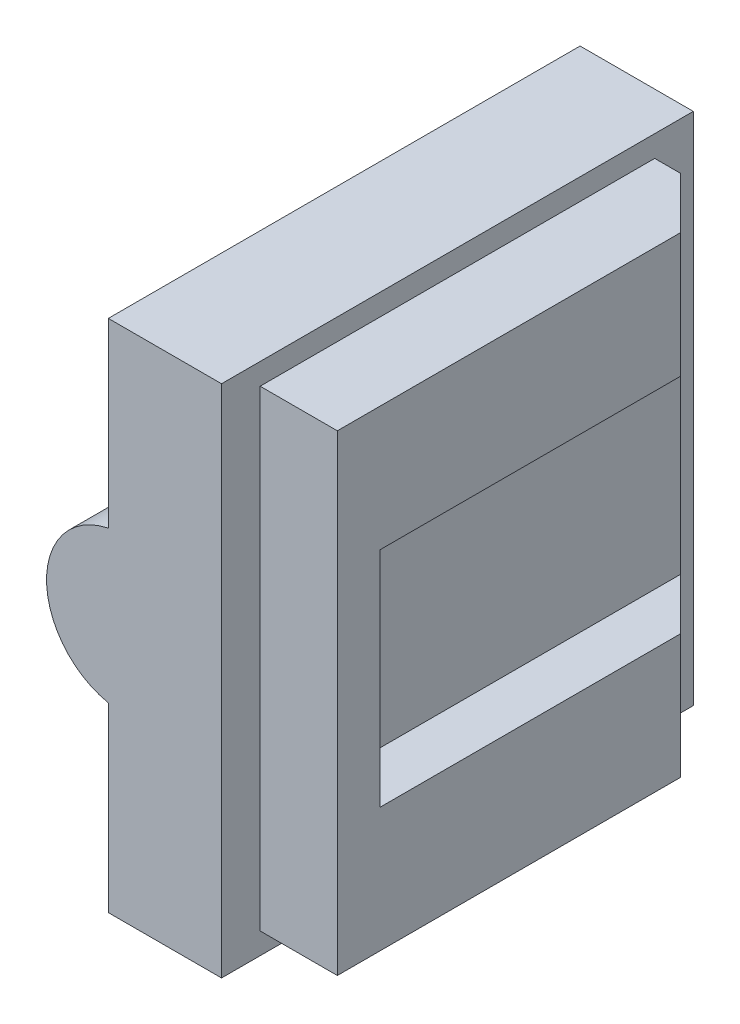
from build123d import *

# Parameters (mm, degrees)
SKETCH_1_R                 = 2.9
EXTRUDE_1_DEPTH            = 30
SKETCH_2_W                 = 27.5
SKETCH_2_H                 = 30
EXTRUDE_2_DEPTH            = 17
CUT_EXTRUDE_1_REACH        = 39.833
SKETCH_3_W                 = 27.5
SKETCH_3_H                 = 19.8
SKETCH_4_W                 = 27.5
SKETCH_4_H                 = 30
SKETCH_4_W_2               = 23
SKETCH_4_H_2               = 27.5
CUT_EXTRUDE_2_DEPTH        = 4.5
CHAMFER_1_SIZE             = 3
SKETCH_5_W                 = 20.5
SKETCH_5_H                 = 13
CUT_EXTRUDE_3_DEPTH        = 3
SKETCH_6_R                 = 7.5
SKETCH_6_R_2               = 2.9
EXTRUDE_3_DEPTH            = 2.2
CHAMFER_2_SIZE             = 2
CHAMFER_2_OF_MIRROR_1_SIZE = 2
CUT_EXTRUDE_4_REACH        = 52.113
SKETCH_7_W                 = 25
SKETCH_7_H                 = 34.4
SKETCH_8_W                 = 25.25
SKETCH_8_H                 = 27.75
SKETCH_8_W_2               = 24.85
SKETCH_8_H_2               = 27.35
EXTRUDE_4_DEPTH            = 0.5
SKETCH_9_W                 = 24.85
SKETCH_9_H                 = 27.35
CUT_EXTRUDE_5_DEPTH        = 5
SKETCH_10_R                = 4.5
EXTRUDE_5_DEPTH            = 5
SKETCH_11_R                = 2.85
SKETCH_11_R_2              = 0.85
EXTRUDE_6_DEPTH            = 5


with BuildPart() as part:
    # 草图1 → 凸台-拉伸1 (new body)
    with BuildSketch(Plane(origin=(0, 0, 0), x_dir=(1, 0, 0), z_dir=(0, 1, 0))):
        with BuildLine():
            Line((-0.305751289, 8.694625705), (9.8, 9.05))
            Line((9.8, 9.05), (9.8, -9.05))
            Line((9.8, -9.05), (-0.305751289, -8.694625705))
            ThreePointArc((-0.305751289, -8.694625705), (-8.7, 0), (-0.305751289, 8.694625705))
        make_face()
        with Locations(Location((0, 0, 0), (0, 0, 270))):
            Circle(SKETCH_1_R, mode=Mode.SUBTRACT)
    extrude(amount=EXTRUDE_1_DEPTH)

    # 草图2 → 凸台-拉伸2 (add)
    with BuildSketch(Plane(origin=(9.8, 0, 0), x_dir=(0, 0, -1), z_dir=(1, 0, 0))):
        with Locations((0, 15)):
            Rectangle(SKETCH_2_W, SKETCH_2_H)
    extrude(amount=EXTRUDE_2_DEPTH)

    # 草图3 → 切除-拉伸1 (cut, up to next)
    with BuildSketch(Plane.ZY.offset(-9.8), mode=Mode.PRIVATE) as cut_extrude_1_sk1:
        with Locations((0, 15)):
            Rectangle(SKETCH_3_W, SKETCH_3_H)
    cut_extrude_1_tool1 = extrude(cut_extrude_1_sk1.sketch, amount=CUT_EXTRUDE_1_REACH, mode=Mode.PRIVATE) & part.part
    add(cut_extrude_1_tool1.solids().sort_by_distance((9.8, 15, 0))[0], mode=Mode.SUBTRACT)

    # 草图4 → 切除-拉伸2 (cut)
    with BuildSketch(Plane(origin=(26.8, 0, 0), x_dir=(0, 0, -1), z_dir=(1, 0, 0))):
        with Locations((0, 15)):
            Rectangle(SKETCH_4_W, SKETCH_4_H)
        with Locations((0, 15)):
            Rectangle(SKETCH_4_W_2, SKETCH_4_H_2, mode=Mode.SUBTRACT)
    extrude(amount=-CUT_EXTRUDE_2_DEPTH, mode=Mode.SUBTRACT)

    # 倒角1
    chamfer_1_edges = [part.edges().sort_by_distance(p)[0] for p in [
        (26.8, 15, -11.5),
    ]]
    chamfer(chamfer_1_edges, length=CHAMFER_1_SIZE)

    # 草图5 → 切除-拉伸3 (cut)
    with BuildSketch(Plane(origin=(26.8, 0, 0), x_dir=(0, 0, -1), z_dir=(1, 0, 0))):
        with Locations((1.25, 15)):
            Rectangle(SKETCH_5_W, SKETCH_5_H)
    extrude(amount=-CUT_EXTRUDE_3_DEPTH, mode=Mode.SUBTRACT)

    # 草图6 → 凸台-拉伸3 (add)
    with BuildSketch(Plane(origin=(0, 30, 0), x_dir=(1, 0, 0), z_dir=(0, 1, 0))):
        with Locations(Location((0, 0, 0), (0, 0, 270))):
            Circle(SKETCH_6_R)
        with Locations(Location((0, 0, 0), (0, 0, 270))):
            Circle(SKETCH_6_R_2, mode=Mode.SUBTRACT)
    extrude_3 = extrude(amount=EXTRUDE_3_DEPTH)

    # 倒角2
    chamfer_2_edges = [part.edges().sort_by_distance(p)[0] for p in [
        (0, 32.2, -7.5),
    ]]
    chamfer(chamfer_2_edges, length=CHAMFER_2_SIZE)

    # 镜向1: 凸台-拉伸3 across plane
    add(extrude_3.mirror(Plane(origin=(0, 15, 0), x_dir=(0, 0, 1), z_dir=(0, -1, 0))))

    # 倒角2 of 镜向1
    chamfer_2_of_mirror_1_edges = [part.edges().sort_by_distance(p)[0] for p in [
        (0, -2.2, -7.5),
    ]]
    chamfer(chamfer_2_of_mirror_1_edges, length=CHAMFER_2_OF_MIRROR_1_SIZE)

    # 草图7 → 切除-拉伸4 (cut, up to next)
    with BuildSketch(Plane(origin=(0, 0, -13.75), x_dir=(-1, 0, 0), z_dir=(0, 0, -1)), mode=Mode.PRIVATE) as cut_extrude_4_sk1:
        with Locations((-3.2, 15)):
            Rectangle(SKETCH_7_W, SKETCH_7_H)
    cut_extrude_4_tool1 = extrude(cut_extrude_4_sk1.sketch, amount=-CUT_EXTRUDE_4_REACH, mode=Mode.PRIVATE) & part.part
    add(cut_extrude_4_tool1.solids().sort_by_distance((3.2, 15, -13.75))[0], mode=Mode.SUBTRACT)

    # 草图8 → 凸台-拉伸4 (add)
    with BuildSketch(Plane.ZY.offset(-15.7)):
        with Locations((0, 15)):
            Rectangle(SKETCH_8_W, SKETCH_8_H)
        with Locations((0, 15)):
            Rectangle(SKETCH_8_W_2, SKETCH_8_H_2, mode=Mode.SUBTRACT)
    extrude(amount=EXTRUDE_4_DEPTH)

    # 草图9 → 切除-拉伸5 (cut)
    with BuildSketch(Plane.ZY.offset(-15.7)):
        with Locations((0, 15)):
            Rectangle(SKETCH_9_W, SKETCH_9_H)
    extrude(amount=-CUT_EXTRUDE_5_DEPTH, mode=Mode.SUBTRACT)

    # 草图10 → 凸台-拉伸5 (add)
    with BuildSketch(Plane.XY.offset(13.75)):
        with Locations((16.6, 15)):
            Circle(SKETCH_10_R)
    extrude(amount=-EXTRUDE_5_DEPTH)

    # 草图11 → 凸台-拉伸6 (add)
    # profile 1 of 4: a face of its own
    with BuildSketch(Plane.ZY.offset(-15.7)):
        with Locations((-10.5, 26.5)):
            Circle(SKETCH_11_R)
        with Locations(Location((-10.5, 26.5, 0), (0, 0, 270))):
            Circle(SKETCH_11_R_2, mode=Mode.SUBTRACT)
    # profile 2 of 4: a face of its own
    with BuildSketch(Plane.ZY.offset(-15.7)):
        with Locations((10.5, 26.5)):
            Circle(SKETCH_11_R)
        with Locations(Location((10.5, 26.5, 0), (0, 0, 270))):
            Circle(SKETCH_11_R_2, mode=Mode.SUBTRACT)
    # profile 3 of 4: a face of its own
    with BuildSketch(Plane.ZY.offset(-15.7)):
        with Locations((-10.5, 3.5)):
            Circle(SKETCH_11_R)
        with Locations(Location((-10.5, 3.5, 0), (0, 0, 270))):
            Circle(SKETCH_11_R_2, mode=Mode.SUBTRACT)
    # profile 4 of 4: a face of its own
    with BuildSketch(Plane.ZY.offset(-15.7)):
        with Locations((10.5, 3.5)):
            Circle(SKETCH_11_R)
        with Locations(Location((10.5, 3.5, 0), (0, 0, 270))):
            Circle(SKETCH_11_R_2, mode=Mode.SUBTRACT)
    extrude(amount=-EXTRUDE_6_DEPTH)


solid = part.part
